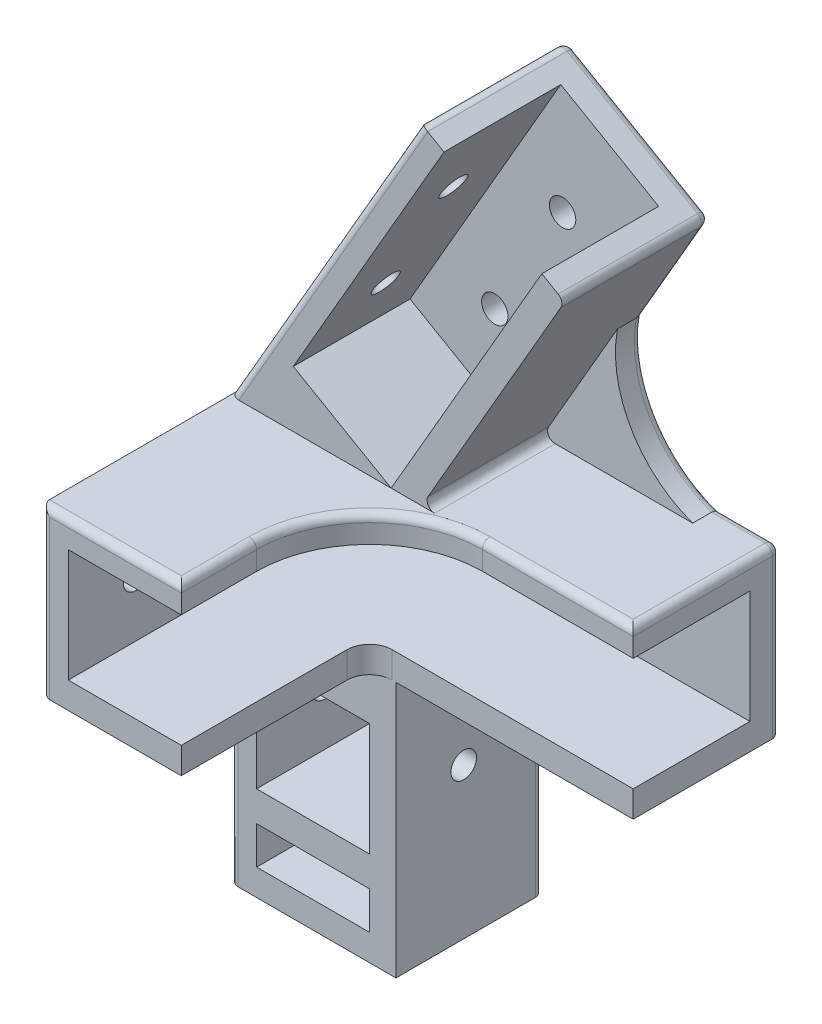
from build123d import *

# Parameters (mm, degrees)
BOSS_EXTRUDE1_DEPTH  = 19.5
SKETCH3_W            = 18.5
SKETCH3_H            = 22
BOSS_EXTRUDE2_DEPTH  = 25
SKETCH5_W            = 50
SKETCH5_H            = 15
SKETCH5_W_2          = 15
SKETCH5_H_2          = 5
CUT_EXTRUDE1_DEPTH   = 40.5
BOSS_EXTRUDE4_DEPTH  = 3.5
BOSS_EXTRUDE5_DEPTH  = 3.5
BOSS_EXTRUDE6_DEPTH  = 3.5
FILLET3_R            = 3
CUT_EXTRUDE3_DEPTH   = 1
SKETCH12_R           = 1.7
CUT_EXTRUDE4_DEPTH   = 5
SKETCH13_R           = 1.7
CUT_EXTRUDE5_DEPTH   = 45
SKETCH14_R           = 1.7
CUT_EXTRUDE6_DEPTH   = 45
SKETCH15_R           = 1.7
CUT_EXTRUDE7_DEPTH   = 4
FILLET3_OF_MIRROR2_R = 3
SKETCH16_W           = 70.294928241
SKETCH16_H           = 57.866283398
CUT_EXTRUDE8_DEPTH   = 72
BOSS_EXTRUDE7_DEPTH  = 19.5
CUT_EXTRUDE10_DEPTH  = 15.5
BOSS_EXTRUDE8_DEPTH  = 3.5
FILLET4_R            = 1
FILLET5_R            = 1
SKETCH24_R           = 1.75
CUT_EXTRUDE11_DEPTH  = 10
SKETCH25_R           = 1.75
CUT_EXTRUDE12_DEPTH  = 10


with BuildPart() as part:
    # Sketch1 → Boss-Extrude1 (new body)
    with BuildSketch(Plane.XY):
        Polygon((-5.699410772, 32.916253451), (16.300589228, 32.916253451), (16.300589228, -23.083746549), (-5.699410772, -23.083746549), (-5.699410772, 10.916253451), (-37.199410772, 10.916253451), (-37.199410772, 32.916253451), align=None)
    boss_extrude1 = extrude(amount=BOSS_EXTRUDE1_DEPTH)

    # Sketch3 → Boss-Extrude2 (add)
    with BuildSketch(Plane.XY.offset(19.5)):
        with Locations((7.050589228, 21.916253451)):
            Rectangle(SKETCH3_W, SKETCH3_H)
    boss_extrude2 = extrude(amount=BOSS_EXTRUDE2_DEPTH)

    # Sketch5 → Cut-Extrude1 (cut)
    with BuildSketch(Plane.XY.offset(44.5)):
        with Locations((-12.199410772, 21.916253451)):
            Rectangle(SKETCH5_W, SKETCH5_H)
        with Locations((5.300589228, -3.083746549)):
            Rectangle(SKETCH5_W_2, SKETCH5_H)
        with Locations((5.300589228, -17.083746549)):
            Rectangle(SKETCH5_W_2, SKETCH5_H_2)
    cut_extrude1 = extrude(amount=-CUT_EXTRUDE1_DEPTH, mode=Mode.SUBTRACT)

    # Sketch7 → Boss-Extrude4 (add)
    with BuildSketch(Plane(origin=(16.300589228, 0, 0), x_dir=(0, 0, -1), z_dir=(1, 0, 0))):
        with BuildLine():
            Line((-34.5, 10.916253451), (-19.5, 10.916253451))
            Line((-19.5, 10.916253451), (-19.5, -4.083746549))
            ThreePointArc((-19.5, -4.083746549), (-23.893398282, 6.522855169), (-34.5, 10.916253451))
        make_face()
    boss_extrude4 = extrude(amount=-BOSS_EXTRUDE4_DEPTH)

    # Sketch8 → Boss-Extrude5 (add)
    with BuildSketch(Plane(origin=(0, 0, 0), x_dir=(-1, 0, 0), z_dir=(0, 0, -1))):
        with BuildLine():
            Line((5.699410772, 10.916253451), (20.699410772, 10.916253451))
            ThreePointArc((20.699410772, 10.916253451), (10.092809055, 6.522855169), (5.699410772, -4.083746549))
            Line((5.699410772, -4.083746549), (5.699410772, 10.916253451))
        make_face()
    boss_extrude5 = extrude(amount=-BOSS_EXTRUDE5_DEPTH)

    # Sketch9 → Boss-Extrude6 (add)
    with BuildSketch(Plane(origin=(0, 32.916253451, 0), x_dir=(1, 0, 0), z_dir=(0, 1, 0))):
        with BuildLine():
            Line((-2.199410772, -34.5), (-2.199410772, -19.5))
            Line((-2.199410772, -19.5), (-17.199410772, -19.5))
            ThreePointArc((-17.199410772, -19.5), (-6.592809055, -23.893398282), (-2.199410772, -34.5))
        make_face()
    boss_extrude6 = extrude(amount=-BOSS_EXTRUDE6_DEPTH)

    # Fillet3
    fillet3_edges = [part.edges().sort_by_distance(p)[0] for p in [
        (-2.199410772, 12.666253451, 19.5),
    ]]
    fillet(fillet3_edges, radius=FILLET3_R)

    # Sketch11 → Cut-Extrude3 (cut)
    # profile 1 of 4: a face of its own
    with BuildSketch(Plane(origin=(0, 0, 0), x_dir=(-1, 0, 0), z_dir=(0, 0, -1))):
        Polygon((-10.800589228, -18.789996549), (-10.800589228, -16.838073472), (-2.43039692, -14.652977318), (-10.800589228, -12.463073472), (-10.800589228, -10.515958087), (1.199410772, -8.729900395), (1.199410772, -10.602496549), (-6.379916151, -11.729900395), (1.199410772, -13.715477318), (1.199410772, -15.597688857), (-6.379916151, -17.576054241), (1.199410772, -18.703458087), (1.199410772, -20.576054241), align=None)
    # profile 2 of 4: a face of its own
    with BuildSketch(Plane(origin=(0, 0, 0), x_dir=(-1, 0, 0), z_dir=(0, 0, -1))):
        with BuildLine():
            Line((-10.800589228, -7.991438857), (-10.800589228, -5.952977318))
            add(Edge.make_bspline(
                [(-10.800589228, -5.952977318), (-10.800005012, -5.818337024), (-10.798881276, -5.559357226), (-10.780939362, -5.185841664), (-10.756194453, -4.841644627), (-10.717588986, -4.528141475), (-10.670910939, -4.244422827), (-10.610297955, -3.991812577), (-10.542991354, -3.767135176), (-10.432899575, -3.510089545), (-10.261344606, -3.2204116), (-9.993854575, -2.916502166), (-9.674999978, -2.642644015), (-9.298421338, -2.412342144), (-8.876833149, -2.221736808), (-8.412796045, -2.089022583), (-7.914245505, -2.00467731), (-7.569376461, -1.995936272), (-7.391935381, -1.991438857)],
                knots=[0, 0, 0, 0, 1.067446855, 2.053227611, 2.964447842, 3.802928181, 4.55705831, 5.242813606, 5.861740442, 6.41401137, 7.456762865, 8.515266784, 9.610284097, 10.777391769, 12.003071174, 13.267653188, 14.594160368, 16, 16, 16, 16], degree=3))
            add(Edge.make_bspline(
                [(-7.391935381, -1.991438857), (-7.297355032, -1.992855248), (-7.111944506, -1.99563187), (-6.839545611, -2.016474255), (-6.57922187, -2.056818659), (-6.329385024, -2.104637483), (-6.092864844, -2.173393793), (-5.86736032, -2.254741183), (-5.654862929, -2.353204183), (-5.453365078, -2.465039747), (-5.262464902, -2.588608019), (-5.086843378, -2.732896484), (-4.9205107, -2.888692529), (-4.766123648, -3.059365613), (-4.626046251, -3.246963608), (-4.496602326, -3.448494847), (-4.377999142, -3.665222723), (-4.310704173, -3.817832702), (-4.276550766, -3.895285011)],
                knots=[0, 0, 0, 0, 1.163181294, 2.28024169, 3.356120165, 4.401649984, 5.406013808, 6.381787017, 7.347406326, 8.282525473, 9.21452408, 10.139462981, 11.073595085, 12.01554303, 12.965498088, 13.949545959, 14.959357709, 16, 16, 16, 16], degree=3))
            Line((-4.276550766, -3.895285011), (1.199410772, -1.452977318))
            Line((1.199410772, -1.452977318), (1.199410772, -3.541919626))
            Line((1.199410772, -3.541919626), (-4.031358458, -5.873650395))
            Line((-4.031358458, -5.873650395), (-4.031358458, -6.145285011))
            Line((-4.031358458, -6.145285011), (1.199410772, -6.145285011))
            Line((1.199410772, -6.145285011), (1.199410772, -7.991438857))
            Line((1.199410772, -7.991438857), (-10.800589228, -7.991438857))
        make_face()
        with BuildLine():
            Line((-6.185204612, -6.145285011), (-6.185204612, -5.515477318))
            add(Edge.make_bspline(
                [(-6.185204612, -5.515477318), (-6.186367141, -5.438550003), (-6.188596807, -5.291007573), (-6.198784481, -5.078941418), (-6.223636793, -4.886497292), (-6.255016899, -4.712471663), (-6.291026717, -4.555276318), (-6.342625913, -4.418389599), (-6.399049431, -4.298462814), (-6.489896288, -4.166118437), (-6.633796999, -4.027471922), (-6.856716063, -3.91397639), (-7.124487444, -3.84724369), (-7.317795964, -3.840947182), (-7.420781535, -3.837592703)],
                knots=[0, 0, 0, 0, 1.14443165, 2.194958024, 3.155864406, 4.02787753, 4.825710302, 5.549708663, 6.200008757, 6.791751392, 7.929772656, 9.129352395, 10.470655706, 12, 12, 12, 12], degree=3))
            add(Edge.make_bspline(
                [(-7.420781535, -3.837592703), (-7.484265153, -3.839856392), (-7.607360624, -3.844245712), (-7.785755229, -3.879686188), (-7.952879051, -3.933201989), (-8.103735349, -4.014031264), (-8.239800846, -4.109799367), (-8.356212547, -4.223260262), (-8.450592564, -4.353040951), (-8.531146795, -4.502587927), (-8.586059735, -4.694350085), (-8.620716321, -4.939833657), (-8.644326337, -5.246603017), (-8.645891807, -5.472154526), (-8.646743074, -5.594804241)],
                knots=[0, 0, 0, 0, 0.9241003, 1.791841178, 2.640927318, 3.471185814, 4.274581995, 5.058835706, 5.827024317, 6.605084504, 7.520888769, 8.714677486, 10.213517293, 12, 12, 12, 12], degree=3))
            Line((-8.646743074, -5.594804241), (-8.646743074, -6.145285011))
            Line((-8.646743074, -6.145285011), (-6.185204612, -6.145285011))
        make_face(mode=Mode.SUBTRACT)
    # profile 3 of 4: a face of its own
    with BuildSketch(Plane(origin=(0, 0, 0), x_dir=(-1, 0, 0), z_dir=(0, 0, -1))):
        with BuildLine():
            add(Edge.make_bspline(
                [(-1.262127689, -0.176054241), (-1.257647984, -0.104101941), (-1.248753835, 0.038754448), (-1.172545764, 0.242235867), (-1.05033496, 0.427832621), (-0.88404186, 0.590235666), (-0.687299125, 0.730105266), (-0.462023761, 0.828247267), (-0.217504351, 0.891566147), (-0.046993635, 0.897708021), (0.040756926, 0.900868836)],
                knots=[0, 0, 0, 0, 0.919349048, 1.825304879, 2.744940427, 3.746623331, 4.786044724, 5.819977252, 6.878086821, 8, 8, 8, 8], degree=3))
            add(Edge.make_bspline(
                [(0.040756926, 0.900868836), (0.128481887, 0.897613897), (0.299721778, 0.891260229), (0.545324854, 0.828809783), (0.771582895, 0.729449747), (0.970335119, 0.590396057), (1.138671939, 0.427821465), (1.264004419, 0.242957175), (1.339760461, 0.038678283), (1.348736151, -0.104127453), (1.353256926, -0.176054241)],
                knots=[0, 0, 0, 0, 1.117536417, 2.181440851, 3.211339843, 4.255104211, 5.260135653, 6.181815925, 7.084237479, 8, 8, 8, 8], degree=3))
            add(Edge.make_bspline(
                [(1.353256926, -0.176054241), (1.348770157, -0.248001687), (1.339861983, -0.390848436), (1.263364391, -0.595455675), (1.139460356, -0.781986068), (0.970956709, -0.945114294), (0.77080448, -1.081189928), (0.54542444, -1.181069939), (0.299695058, -1.243328016), (0.128472836, -1.249708594), (0.040756926, -1.252977318)],
                knots=[0, 0, 0, 0, 0.915447906, 1.817559426, 2.747445231, 3.752131388, 4.789763433, 5.819308596, 6.882847519, 8, 8, 8, 8], degree=3))
            add(Edge.make_bspline(
                [(0.040756926, -1.252977318), (-0.046984438, -1.249802679), (-0.217477284, -1.243633944), (-0.462123928, -1.180506316), (-0.686511891, -1.081845741), (-0.884668075, -0.944947749), (-1.051117925, -0.781983335), (-1.171904853, -0.594743665), (-1.248854997, -0.390923093), (-1.257681869, -0.248026694), (-1.262127689, -0.176054241)],
                knots=[0, 0, 0, 0, 1.121525552, 2.179269538, 3.212844836, 4.246063491, 5.247400307, 6.175325774, 7.080968592, 8, 8, 8, 8], degree=3))
        make_face()
    # profile 4 of 4: a face of its own
    with BuildSketch(Plane(origin=(0, 0, 0), x_dir=(-1, 0, 0), z_dir=(0, 0, -1))):
        with BuildLine():
            Line((-7.877512305, 3.639330374), (-7.877512305, 1.793176528))
            add(Edge.make_bspline(
                [(-7.877512305, 1.793176528), (-7.985104597, 1.806156245), (-8.194919789, 1.831467926), (-8.50062502, 1.89307865), (-8.789725475, 1.969009097), (-9.063857289, 2.060670567), (-9.32041803, 2.168002956), (-9.560895844, 2.292709709), (-9.787587098, 2.42930416), (-9.925017131, 2.537709574), (-9.99289692, 2.591253451)],
                knots=[0, 0, 0, 0, 1.13409845, 2.211599726, 3.261451197, 4.261463951, 5.235132031, 6.169264622, 7.095758548, 8, 8, 8, 8], degree=3))
            add(Edge.make_bspline(
                [(-9.99289692, 2.591253451), (-10.082013161, 2.667910273), (-10.256359415, 2.817881026), (-10.483761061, 3.07110519), (-10.676767562, 3.337669411), (-10.835123876, 3.619879277), (-10.958228421, 3.915924445), (-11.044683072, 4.227572925), (-11.099664631, 4.553240287), (-11.10537913, 4.776126179), (-11.108281535, 4.889330374)],
                knots=[0, 0, 0, 0, 1.065406432, 2.084352066, 3.078868942, 4.045367136, 5.013203651, 5.979674514, 6.9738726, 8, 8, 8, 8], degree=3))
            add(Edge.make_bspline(
                [(-11.108281535, 4.889330374), (-11.105554752, 4.990429502), (-11.100204953, 5.188780494), (-11.056686246, 5.480236578), (-10.97985421, 5.757907044), (-10.8818086, 6.026068289), (-10.745230943, 6.277428113), (-10.587175591, 6.520140361), (-10.396186865, 6.748620977), (-10.177194209, 6.959885993), (-9.943110555, 7.156839202), (-9.690759412, 7.324416021), (-9.43059281, 7.47074821), (-9.157422302, 7.588703888), (-8.873189212, 7.680392593), (-8.578388089, 7.744054748), (-8.273858918, 7.787935844), (-8.06677444, 7.791411893), (-7.96164692, 7.793176528)],
                knots=[0, 0, 0, 0, 1.018635126, 1.998506719, 2.96030997, 3.918683232, 4.868719089, 5.836268132, 6.834011598, 7.861887245, 8.899958098, 9.91230014, 10.909978245, 11.904579616, 12.905650751, 13.91466998, 14.941371293, 16, 16, 16, 16], degree=3))
            add(Edge.make_bspline(
                [(-7.96164692, 7.793176528), (-7.831571704, 7.7882504), (-7.575267724, 7.778543815), (-7.199658116, 7.710806724), (-6.842854452, 7.593710225), (-6.50564623, 7.43251906), (-6.191993909, 7.228071619), (-5.907939838, 6.979968911), (-5.654954295, 6.689672154), (-5.517272776, 6.469896674), (-5.447223843, 6.358080374)],
                knots=[0, 0, 0, 0, 1.027701034, 2.025011931, 3.004147813, 3.986880317, 4.970346872, 5.953160964, 6.958619193, 8, 8, 8, 8], degree=3))
            add(Edge.make_bspline(
                [(-5.447223843, 6.358080374), (-5.418934484, 6.430798423), (-5.362819656, 6.575042087), (-5.255412748, 6.779194324), (-5.134751997, 6.973329501), (-4.999067172, 7.154540458), (-4.847347238, 7.322970358), (-4.681616094, 7.478791827), (-4.500395305, 7.624150933), (-4.30375287, 7.755244697), (-4.095176448, 7.873355347), (-3.875726079, 7.97347104), (-3.648685489, 8.060719415), (-3.412791492, 8.133216192), (-3.166864793, 8.188590605), (-2.911254324, 8.225884056), (-2.647259211, 8.251365722), (-2.468118928, 8.253589988), (-2.377512305, 8.254714989)],
                knots=[0, 0, 0, 0, 0.971157749, 1.926390409, 2.867917292, 3.816032967, 4.741824403, 5.6878893, 6.646452846, 7.631864642, 8.628382992, 9.628642509, 10.633224323, 11.656081692, 12.699617594, 13.76949873, 14.871843985, 16, 16, 16, 16], degree=3))
            add(Edge.make_bspline(
                [(-2.377512305, 8.254714989), (-2.244325252, 8.252503818), (-1.981850533, 8.248146212), (-1.597044081, 8.197009582), (-1.226862615, 8.122689872), (-0.874542963, 8.009706698), (-0.536107314, 7.870492658), (-0.212201339, 7.699845341), (0.092892066, 7.493753909), (0.380575775, 7.261849568), (0.643411265, 7.006428676), (0.8765742, 6.732895346), (1.069672671, 6.437585756), (1.23223783, 6.128720843), (1.355158488, 5.799574581), (1.443839147, 5.455657192), (1.498563993, 5.093806224), (1.504216675, 4.847057422), (1.50710308, 4.721061143)],
                knots=[0, 0, 0, 0, 1.08934669, 2.146800001, 3.171892192, 4.175766193, 5.1695646, 6.164076811, 7.166278581, 8.178196077, 9.184573215, 10.16196427, 11.113242845, 12.066531174, 13.012937118, 13.981620827, 14.969363733, 16, 16, 16, 16], degree=3))
            add(Edge.make_bspline(
                [(1.50710308, 4.721061143), (1.504031919, 4.602279119), (1.498005885, 4.36921268), (1.44571629, 4.02762683), (1.362713421, 3.702437153), (1.243881772, 3.394298005), (1.091092441, 3.104692046), (0.906771997, 2.829859086), (0.687442467, 2.57259779), (0.434322499, 2.3350891), (0.15282569, 2.119255522), (-0.153407037, 1.926340908), (-0.483775783, 1.75924538), (-0.840338868, 1.624378739), (-1.217591782, 1.506817115), (-1.621739126, 1.421885121), (-2.049128635, 1.361769677), (-2.342880764, 1.341824077), (-2.49289692, 1.331638066)],
                knots=[0, 0, 0, 0, 0.974003266, 1.911126485, 2.827923683, 3.722775623, 4.613731572, 5.50894563, 6.432318302, 7.38099101, 8.351349308, 9.338047726, 10.346428225, 11.382873954, 12.462111462, 13.585146545, 14.766759469, 16, 16, 16, 16], degree=3))
            Line((-2.49289692, 1.331638066), (-2.49289692, 3.177791913))
            add(Edge.make_bspline(
                [(-2.49289692, 3.177791913), (-2.417425318, 3.188945376), (-2.270574462, 3.210647521), (-2.058705359, 3.256683558), (-1.861732034, 3.311165199), (-1.680044741, 3.376135049), (-1.514279405, 3.45120486), (-1.360798784, 3.532148117), (-1.223710633, 3.625749249), (-1.065384613, 3.762941693), (-0.896220111, 3.953356149), (-0.749458771, 4.217045491), (-0.662515335, 4.51137642), (-0.652102457, 4.7164657), (-0.646743074, 4.822022682)],
                knots=[0, 0, 0, 0, 1.004083628, 1.953722164, 2.852062002, 3.692886634, 4.490800013, 5.245942238, 5.974461452, 6.670088602, 8.000762069, 9.303976857, 10.612389357, 12, 12, 12, 12], degree=3))
            add(Edge.make_bspline(
                [(-0.646743074, 4.822022682), (-0.647864371, 4.878202331), (-0.650053976, 4.987906785), (-0.675076379, 5.149181645), (-0.716357012, 5.302683497), (-0.770574005, 5.45033855), (-0.844338553, 5.58810378), (-0.931901508, 5.719433893), (-1.034609515, 5.844770146), (-1.195110626, 5.995917646), (-1.416786421, 6.163242766), (-1.719322479, 6.30573827), (-2.050588673, 6.3928176), (-2.280814454, 6.403216349), (-2.39914692, 6.408561143)],
                knots=[0, 0, 0, 0, 0.766703657, 1.497175717, 2.221804895, 2.935192376, 3.640052165, 4.350243223, 5.088623085, 5.847082799, 7.357237736, 8.859920549, 10.386048059, 12, 12, 12, 12], degree=3))
            add(Edge.make_bspline(
                [(-2.39914692, 6.408561143), (-2.464945748, 6.406711942), (-2.594787133, 6.403062896), (-2.786195597, 6.374088866), (-2.969648465, 6.322755274), (-3.145763747, 6.253440485), (-3.312932079, 6.163011753), (-3.473227413, 6.054384045), (-3.62413007, 5.923172242), (-3.768170684, 5.775714059), (-3.898710135, 5.608114668), (-4.014720541, 5.423570124), (-4.109640596, 5.219059789), (-4.193220285, 4.999736952), (-4.254214347, 4.760765565), (-4.29872396, 4.505093902), (-4.332010414, 4.232310528), (-4.336655471, 4.044084373), (-4.339050766, 3.947022682)],
                knots=[0, 0, 0, 0, 0.899536996, 1.775063972, 2.638995881, 3.499655969, 4.357521698, 5.232774386, 6.141935922, 7.087285127, 8.047315231, 9.041502366, 10.060909586, 11.125312509, 12.246833879, 13.426779274, 14.673079445, 16, 16, 16, 16], degree=3))
            Line((-4.339050766, 3.947022682), (-6.339050766, 3.947022682))
            add(Edge.make_bspline(
                [(-6.339050766, 3.947022682), (-6.351211097, 4.070597942), (-6.374042407, 4.302613426), (-6.427589871, 4.624478183), (-6.497441604, 4.896812425), (-6.588065699, 5.121571579), (-6.694964612, 5.310796304), (-6.816990742, 5.474794656), (-6.9584857, 5.616776513), (-7.116669669, 5.733391795), (-7.285211073, 5.826558536), (-7.45907096, 5.899690982), (-7.641166228, 5.937102036), (-7.763594277, 5.943722311), (-7.824627689, 5.947022682)],
                knots=[0, 0, 0, 0, 1.613490305, 3.029366345, 4.236845818, 5.259854129, 6.169213254, 7.054399038, 7.908596932, 8.76463379, 9.599115534, 10.407455461, 11.206077139, 12, 12, 12, 12], degree=3))
            add(Edge.make_bspline(
                [(-7.824627689, 5.947022682), (-7.902708499, 5.94339984), (-8.054533682, 5.93635536), (-8.271474473, 5.879601033), (-8.4685132, 5.787571995), (-8.638517306, 5.657006158), (-8.780104567, 5.497937744), (-8.882578523, 5.311699797), (-8.945232074, 5.101614866), (-8.951293618, 4.953882443), (-8.954435381, 4.877311143)],
                knots=[0, 0, 0, 0, 1.073009827, 2.08642706, 3.062829201, 4.046239177, 5.014892964, 5.972187552, 6.948963055, 8, 8, 8, 8], degree=3))
            add(Edge.make_bspline(
                [(-8.954435381, 4.877311143), (-8.95071032, 4.808009077), (-8.94335375, 4.671145417), (-8.884755184, 4.47123759), (-8.789639268, 4.281474968), (-8.656940841, 4.105904867), (-8.497545942, 3.947245812), (-8.310497414, 3.816432348), (-8.104113715, 3.708690565), (-7.953735758, 3.662661532), (-7.877512305, 3.639330374)],
                knots=[0, 0, 0, 0, 0.942455657, 1.861242209, 2.81281304, 3.818879151, 4.845099048, 5.862404497, 6.916497371, 8, 8, 8, 8], degree=3))
        make_face()
    extrude(amount=-CUT_EXTRUDE3_DEPTH, mode=Mode.SUBTRACT)

    # Sketch12 → Cut-Extrude4 (cut)
    with BuildSketch(Plane(origin=(0, 0, 0), x_dir=(-1, 0, 0), z_dir=(0, 0, -1))):
        with Locations((-5.300589228, 21.916253451)):
            Circle(SKETCH12_R)
        with Locations((10.949410772, 21.916253451)):
            Circle(SKETCH12_R)
        with Locations((27.199410772, 21.916253451)):
            Circle(SKETCH12_R)
    cut_extrude4 = extrude(amount=-CUT_EXTRUDE4_DEPTH, mode=Mode.SUBTRACT)

    # Sketch13 → Cut-Extrude5 (cut)
    with BuildSketch(Plane.ZY.offset(5.699410772)):
        with Locations(Location((10.5, -3.083746549, 0), (0, 0, 270))):
            Circle(SKETCH13_R)
    cut_extrude5 = extrude(amount=-CUT_EXTRUDE5_DEPTH, mode=Mode.SUBTRACT)

    # Sketch14 → Cut-Extrude6 (cut)
    with BuildSketch(Plane(origin=(16.300589228, 0, 0), x_dir=(0, 0, -1), z_dir=(1, 0, 0))):
        with Locations(Location((-10.5, 21.916253451, 0), (0, 0, 90))):
            Circle(SKETCH14_R)
        with Locations(Location((-35.5, 21.916253451, 0), (0, 0, 90))):
            Circle(SKETCH14_R)
    cut_extrude6 = extrude(amount=-CUT_EXTRUDE6_DEPTH, mode=Mode.SUBTRACT)

    # Sketch15 → Cut-Extrude7 (cut)
    with BuildSketch(Plane.XZ.offset(23.083746549)):
        with Locations(Location((5.300589228, 9.75, 0), (0, 0, 270))):
            Circle(SKETCH15_R)
    cut_extrude7 = extrude(amount=-CUT_EXTRUDE7_DEPTH, mode=Mode.SUBTRACT)

    # Mirror2: Boss-Extrude1, Boss-Extrude2, Cut-Extrude1, Boss-Extrude4, Boss-Extrude5, Boss-Extrude6, Cut-Extrude4, Cut-Extrude5, Cut-Extrude6, Cut-Extrude7 across plane
    add(boss_extrude1.mirror(Plane(origin=(16.300589228, 32.916253451, 19.5), x_dir=(0, 0, 1), z_dir=(-1, 0, 0))))
    add(boss_extrude2.mirror(Plane(origin=(16.300589228, 32.916253451, 19.5), x_dir=(0, 0, 1), z_dir=(-1, 0, 0))))
    add(cut_extrude1.mirror(Plane(origin=(16.300589228, 32.916253451, 19.5), x_dir=(0, 0, 1), z_dir=(-1, 0, 0))), mode=Mode.SUBTRACT)
    add(boss_extrude4.mirror(Plane(origin=(16.300589228, 32.916253451, 19.5), x_dir=(0, 0, 1), z_dir=(-1, 0, 0))))
    add(boss_extrude5.mirror(Plane(origin=(16.300589228, 32.916253451, 19.5), x_dir=(0, 0, 1), z_dir=(-1, 0, 0))))
    add(boss_extrude6.mirror(Plane(origin=(16.300589228, 32.916253451, 19.5), x_dir=(0, 0, 1), z_dir=(-1, 0, 0))))
    add(cut_extrude4.mirror(Plane(origin=(16.300589228, 32.916253451, 19.5), x_dir=(0, 0, 1), z_dir=(-1, 0, 0))), mode=Mode.SUBTRACT)
    add(cut_extrude5.mirror(Plane(origin=(16.300589228, 32.916253451, 19.5), x_dir=(0, 0, 1), z_dir=(-1, 0, 0))), mode=Mode.SUBTRACT)
    add(cut_extrude6.mirror(Plane(origin=(16.300589228, 32.916253451, 19.5), x_dir=(0, 0, 1), z_dir=(-1, 0, 0))), mode=Mode.SUBTRACT)
    add(cut_extrude7.mirror(Plane(origin=(16.300589228, 32.916253451, 19.5), x_dir=(0, 0, 1), z_dir=(-1, 0, 0))), mode=Mode.SUBTRACT)

    # Fillet3 of Mirror2
    fillet3_of_mirror2_edges = [part.edges().sort_by_distance(p)[0] for p in [
        (34.800589228, 12.666253451, 19.5),
    ]]
    fillet(fillet3_of_mirror2_edges, radius=FILLET3_OF_MIRROR2_R)

    # Sketch16 → Cut-Extrude8 (cut)
    with BuildSketch(Plane(origin=(0, 0, 0), x_dir=(-1, 0, 0), z_dir=(0, 0, -1))):
        with Locations((18.846874893, 3.983111752)):
            Rectangle(SKETCH16_W, SKETCH16_H)
    extrude(amount=-CUT_EXTRUDE8_DEPTH, mode=Mode.SUBTRACT)

    # Sketch21 → Boss-Extrude7 (add)
    with BuildSketch(Plane(origin=(0, 0, 0), x_dir=(-1, 0, 0), z_dir=(0, 0, -1))):
        Polygon((-16.300589228, 32.916253451), (-41.651442189, 76.825218795), (-60.704001072, 65.825218795), (-41.704001072, 32.916253451), align=None)
    extrude(amount=-BOSS_EXTRUDE7_DEPTH)

    # Sketch22 → Cut-Extrude10 (cut)
    with BuildSketch(Plane.XY.offset(19.5)):
        Polygon((44.682531102, 75.075218795), (24.672168131, 40.416253451), (37.662549188, 32.916253451), (57.672912159, 67.575218795), align=None)
    extrude(amount=-CUT_EXTRUDE10_DEPTH, mode=Mode.SUBTRACT)

    # Sketch23 → Boss-Extrude8 (add)
    with BuildSketch(Plane(origin=(0, 0, 0), x_dir=(-1, 0, 0), z_dir=(0, 0, -1))):
        with BuildLine():
            Line((-61.704001072, 32.916253451), (-41.704001072, 32.916253451))
            Line((-41.704001072, 32.916253451), (-51.704001072, 50.236761527))
            ThreePointArc((-51.704001072, 50.236761527), (-53.499675413, 39.726489207), (-61.704001072, 32.916253451))
        make_face()
    extrude(amount=-BOSS_EXTRUDE8_DEPTH)

    # Fillet4
    fillet4_edges = [part.edges().sort_by_distance(p)[0] for p in [
        (16.300589228, 10.916253451, 39.5),
        (16.300589228, 6.522855169, 23.893398282),
        (61.550589228, 10.916253451, 0),
        (42.69398751, 6.522855169, 0),
        (59.800589228, 32.916253451, 19.5),
        (34.800589228, 32.916253451, 39.5),
        (28.976015708, 54.870736123, 19.5),
        (56.204001072, 58.030990161, 0),
        (65.75229515, 32.916253451, 0),
        (53.499675413, 39.726489207, 0),
        (28.976015708, 54.870736123, 0),
        (16.300589228, -13.583746549, 19.5),
        (16.300589228, 4.916253451, 0),
        (38.300589228, -13.583746549, 0),
        (69.800589228, 32.916253451, 9.75),
        (69.800589228, 21.916253451, 0),
        (16.300589228, 21.916253451, 44.5),
        (39.19398751, 32.916253451, 23.893398282),
        (25.550589228, 32.916253451, 44.5),
        (41.651442189, 76.825218795, 9.75),
        (51.17772163, 71.325218795, 0),
        (60.704001072, 65.825218795, 9.75),
    ]]
    fillet(fillet4_edges, radius=FILLET4_R)

    # Fillet5
    fillet5_edges = [part.edges().sort_by_distance(p)[0] for p in [
        (41.704001072, 32.916253451, 11.5),
    ]]
    fillet(fillet5_edges, radius=FILLET5_R)

    # Sketch24 → Cut-Extrude11 (cut)
    with BuildSketch(Plane(origin=(-2.027713922, 1.170701179, 0), x_dir=(0, 0, 1), z_dir=(-0.8660254037844363, 0.5000000000000043, 0))):
        with Locations(Location((12, 74.858312222, 0), (0, 0, 270))):
            Circle(SKETCH24_R)
        with Locations(Location((12, 56.854047417, 0), (0, 0, 270))):
            Circle(SKETCH24_R)
    extrude(amount=-CUT_EXTRUDE11_DEPTH, mode=Mode.SUBTRACT)

    # Sketch25 → Cut-Extrude12 (cut)
    with BuildSketch(Plane(origin=(0, 0, 0), x_dir=(-1, 0, 0), z_dir=(0, 0, -1))):
        with Locations((-44.92772163, 60.499901248)):
            Circle(SKETCH25_R)
        with Locations((-35.925589228, 44.90775055)):
            Circle(SKETCH25_R)
    extrude(amount=-CUT_EXTRUDE12_DEPTH, mode=Mode.SUBTRACT)


solid = part.part
